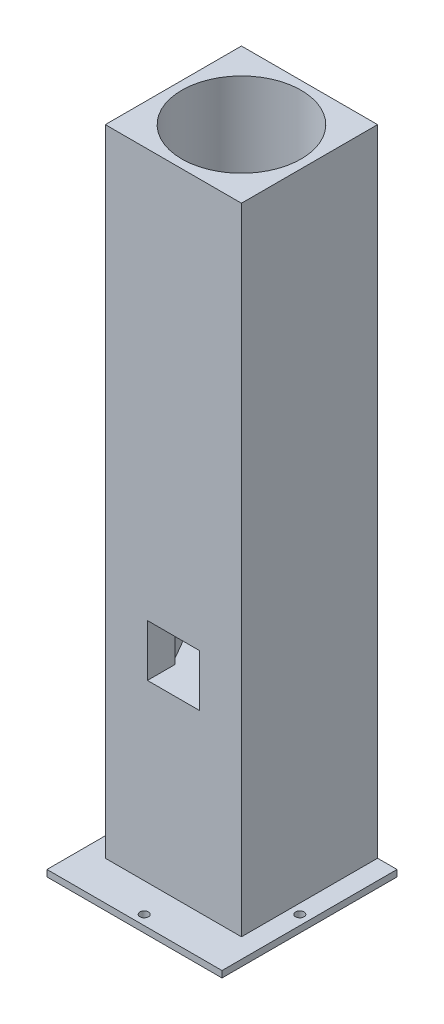
from build123d import *

# Parameters (mm, degrees)
BOSS_EXTRUDE1_DEPTH = 50
BOSS_EXTRUDE2_START = 50
SKETCH2_3_R         = 23
BOSS_EXTRUDE2_DEPTH = 127.5
BOSS_EXTRUDE3_DEPTH = 177.5
SKETCH3_W           = 52.5
SKETCH3_H           = 52.5
BOSS_EXTRUDE4_DEPTH = 70
SKETCH6_W           = 20
SKETCH6_H           = 20
CUT_EXTRUDE7_DEPTH  = 30
SKETCH5_W           = 67.5
SKETCH5_H           = 67.5
SKETCH5_R           = 1.65
SKETCH5_W_2         = 47.5
SKETCH5_H_2         = 47.5
BOSS_EXTRUDE7_DEPTH = 2.5
SKETCH8_W           = 45
SKETCH8_H           = 45
CUT_EXTRUDE9_DEPTH  = 60


with BuildPart() as part:
    # Sketch2 → Boss-Extrude1 (new body)
    with BuildSketch(Plane(origin=(0, 0, 0), x_dir=(1, 0, 0), z_dir=(0, 1, 0))):
        with BuildLine():
            ThreePointArc((-26.25, -11.459990061), (-20.253319138, -20.253319138), (-11.459990061, -26.25))
            Line((-11.459990061, -26.25), (11.459990061, -26.25))
            ThreePointArc((11.459990061, -26.25), (20.253319138, -20.253319138), (26.25, -11.459990061))
            Line((26.25, -11.459990061), (26.25, 11.459990061))
            ThreePointArc((26.25, 11.459990061), (20.253319138, 20.253319138), (11.459990061, 26.25))
            Line((11.459990061, 26.25), (-11.459990061, 26.25))
            ThreePointArc((-11.459990061, 26.25), (-20.253319138, 20.253319138), (-26.25, 11.459990061))
            Line((-26.25, 11.459990061), (-26.25, -11.459990061))
        make_face()
        Polygon((-7.1, 17.237560734), (7.1, 17.237560734), (11.378165495, 14.767560734), (18.478165495, 2.47), (18.478165495, -2.47), (11.378165495, -14.767560734), (7.1, -17.237560734), (-7.1, -17.237560734), (-11.378165495, -14.767560734), (-18.478165495, -2.47), (-18.478165495, 2.47), (-11.378165495, 14.767560734), align=None, mode=Mode.SUBTRACT)
    extrude(amount=BOSS_EXTRUDE1_DEPTH)

    # Sketch2<3> → Boss-Extrude2 (add)
    with BuildSketch(Plane(origin=(0, 0, 0), x_dir=(1, 0, 0), z_dir=(0, 1, 0)).offset(BOSS_EXTRUDE2_START)):
        with BuildLine():
            ThreePointArc((-26.25, -11.459990061), (-20.253319138, -20.253319138), (-11.459990061, -26.25))
            Line((-11.459990061, -26.25), (11.459990061, -26.25))
            ThreePointArc((11.459990061, -26.25), (20.253319138, -20.253319138), (26.25, -11.459990061))
            Line((26.25, -11.459990061), (26.25, 11.459990061))
            ThreePointArc((26.25, 11.459990061), (20.253319138, 20.253319138), (11.459990061, 26.25))
            Line((11.459990061, 26.25), (-11.459990061, 26.25))
            ThreePointArc((-11.459990061, 26.25), (-20.253319138, 20.253319138), (-26.25, 11.459990061))
            Line((-26.25, 11.459990061), (-26.25, -11.459990061))
        make_face()
        with Locations(Location((0, 0, 0), (0, 0, 270))):
            Circle(SKETCH2_3_R, mode=Mode.SUBTRACT)
    extrude(amount=BOSS_EXTRUDE2_DEPTH)

    # Sketch2<4> → Boss-Extrude3 (add)
    with BuildSketch(Plane(origin=(0, 0, 0), x_dir=(1, 0, 0), z_dir=(0, 1, 0))):
        with BuildLine():
            Line((-26.25, 26.25), (-26.25, 11.459990061))
            ThreePointArc((-26.25, 11.459990061), (-20.253319138, 20.253319138), (-11.459990061, 26.25))
            Line((-11.459990061, 26.25), (-26.25, 26.25))
        make_face()
        with BuildLine():
            ThreePointArc((11.459990061, 26.25), (20.253319138, 20.253319138), (26.25, 11.459990061))
            Line((26.25, 11.459990061), (26.25, 26.25))
            Line((26.25, 26.25), (11.459990061, 26.25))
        make_face()
        with BuildLine():
            ThreePointArc((26.25, -11.459990061), (20.253319138, -20.253319138), (11.459990061, -26.25))
            Line((11.459990061, -26.25), (26.25, -26.25))
            Line((26.25, -26.25), (26.25, -11.459990061))
        make_face()
        with BuildLine():
            Line((-26.25, -11.459990061), (-26.25, -26.25))
            Line((-26.25, -26.25), (-11.459990061, -26.25))
            ThreePointArc((-11.459990061, -26.25), (-20.253319138, -20.253319138), (-26.25, -11.459990061))
        make_face()
    extrude(amount=BOSS_EXTRUDE3_DEPTH)

    # Sketch3 → Boss-Extrude4 (add)
    with BuildSketch(Plane.XZ):
        Rectangle(SKETCH3_W, SKETCH3_H)
    extrude(amount=BOSS_EXTRUDE4_DEPTH)

    # Sketch6 → Cut-Extrude7 (cut)
    with BuildSketch(Plane.XY.offset(26.25)):
        with Locations((0, 10)):
            Rectangle(SKETCH6_W, SKETCH6_H)
    extrude(amount=-CUT_EXTRUDE7_DEPTH, mode=Mode.SUBTRACT)

    # Sketch5 → Boss-Extrude7 (add)
    with BuildSketch(Plane.XZ.offset(70)):
        with Locations((0, 7.5)):
            Rectangle(SKETCH5_W, SKETCH5_H)
        with Locations(Location((0, 37.5, 0), (0, 0, 270))):
            Circle(SKETCH5_R, mode=Mode.SUBTRACT)
        with Locations(Location((-30, 7.5, 0), (0, 0, 270))):
            Circle(SKETCH5_R, mode=Mode.SUBTRACT)
        with Locations(Location((30, 7.5, 0), (0, 0, 270))):
            Circle(SKETCH5_R, mode=Mode.SUBTRACT)
        Rectangle(SKETCH5_W_2, SKETCH5_H_2, mode=Mode.SUBTRACT)
    extrude(amount=-BOSS_EXTRUDE7_DEPTH)

    # Sketch8 → Cut-Extrude9 (cut)
    with BuildSketch(Plane.XZ.offset(70)):
        Rectangle(SKETCH8_W, SKETCH8_H)
    extrude(amount=-CUT_EXTRUDE9_DEPTH, mode=Mode.SUBTRACT)


solid = part.part
